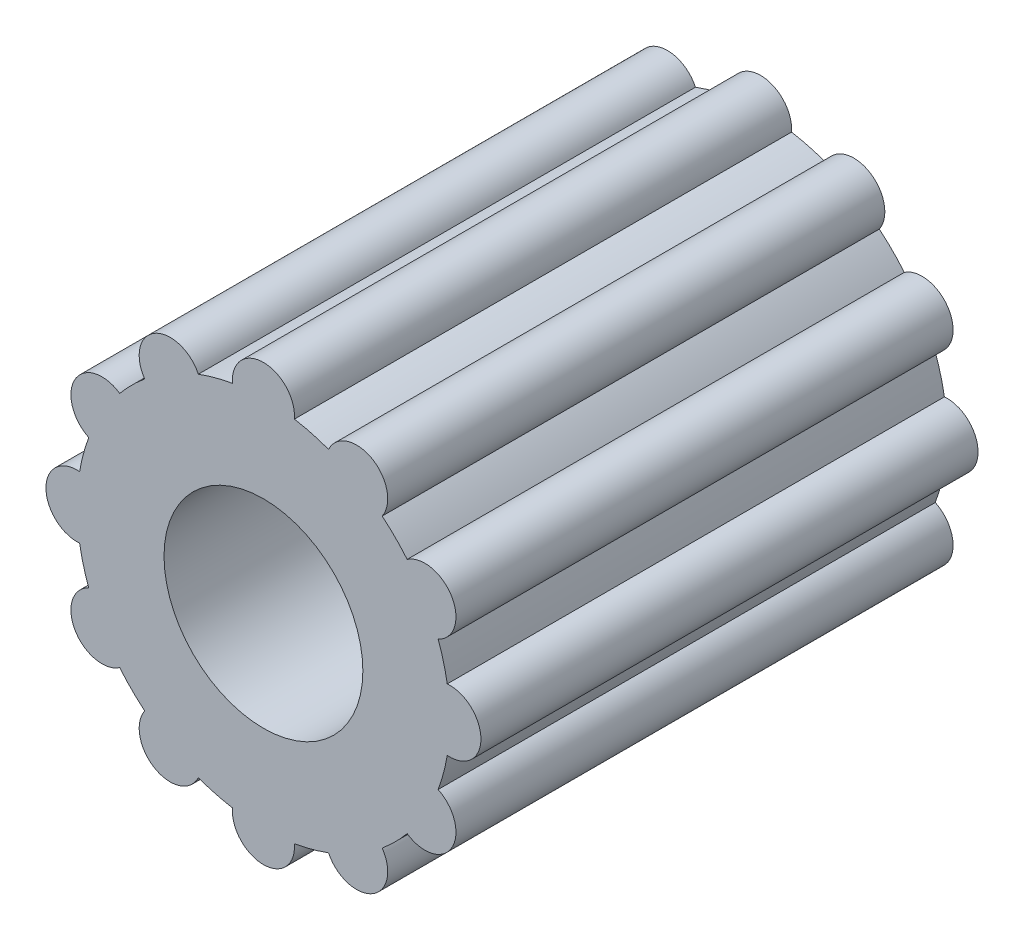
from build123d import *

# Parameters (mm, degrees)
BOSS_EXTRU_1_DEPTH = 4
TROU_TARAUD_M21_D  = 1.6


with BuildPart() as part:
    # Esquisse1 → Boss.-Extru.1 (new body)
    with BuildSketch(Plane.XY):
        with BuildLine():
            ThreePointArc((0.249130432, 1.479166667), (0, 1.75), (-0.249130432, 1.479166667))
            ThreePointArc((-0.249130432, 1.479166667), (-0.388228568, 1.448888739), (-0.52383005, 1.405561126))
            ThreePointArc((-0.52383005, 1.405561126), (-0.875, 1.515544457), (-0.955336616, 1.156430694))
            ThreePointArc((-0.955336616, 1.156430694), (-1.060660172, 1.060660172), (-1.156430694, 0.955336616))
            ThreePointArc((-1.156430694, 0.955336616), (-1.515544457, 0.875), (-1.405561126, 0.52383005))
            ThreePointArc((-1.405561126, 0.52383005), (-1.448888739, 0.388228568), (-1.479166667, 0.249130432))
            ThreePointArc((-1.479166667, 0.249130432), (-1.75, 0), (-1.479166667, -0.249130432))
            ThreePointArc((-1.479166667, -0.249130432), (-1.448888739, -0.388228568), (-1.405561126, -0.52383005))
            ThreePointArc((-1.405561126, -0.52383005), (-1.515544457, -0.875), (-1.156430694, -0.955336616))
            ThreePointArc((-1.156430694, -0.955336616), (-1.060660172, -1.060660172), (-0.955336616, -1.156430694))
            ThreePointArc((-0.955336616, -1.156430694), (-0.875, -1.515544457), (-0.52383005, -1.405561126))
            ThreePointArc((-0.52383005, -1.405561126), (-0.388228568, -1.448888739), (-0.249130432, -1.479166667))
            ThreePointArc((-0.249130432, -1.479166667), (0, -1.75), (0.249130432, -1.479166667))
            ThreePointArc((0.249130432, -1.479166667), (0.388228568, -1.448888739), (0.52383005, -1.405561126))
            ThreePointArc((0.52383005, -1.405561126), (0.875, -1.515544457), (0.955336616, -1.156430694))
            ThreePointArc((0.955336616, -1.156430694), (1.060660172, -1.060660172), (1.156430694, -0.955336616))
            ThreePointArc((1.156430694, -0.955336616), (1.515544457, -0.875), (1.405561126, -0.52383005))
            ThreePointArc((1.405561126, -0.52383005), (1.448888739, -0.388228568), (1.479166667, -0.249130432))
            ThreePointArc((1.479166667, -0.249130432), (1.75, 0), (1.479166667, 0.249130432))
            ThreePointArc((1.479166667, 0.249130432), (1.448888739, 0.388228568), (1.405561126, 0.52383005))
            ThreePointArc((1.405561126, 0.52383005), (1.515544457, 0.875), (1.156430694, 0.955336616))
            ThreePointArc((1.156430694, 0.955336616), (1.060660172, 1.060660172), (0.955336616, 1.156430694))
            ThreePointArc((0.955336616, 1.156430694), (0.875, 1.515544457), (0.52383005, 1.405561126))
            ThreePointArc((0.52383005, 1.405561126), (0.388228568, 1.448888739), (0.249130432, 1.479166667))
        make_face()
    extrude(amount=BOSS_EXTRU_1_DEPTH)

    # Trou taraudé M21 (through all)
    with Locations(Plane(origin=(0, 0, 0), x_dir=(-1, 0, 0), z_dir=(0, 0, -1))):
        with Locations((0, 0)):
            Hole(TROU_TARAUD_M21_D / 2)


solid = part.part
